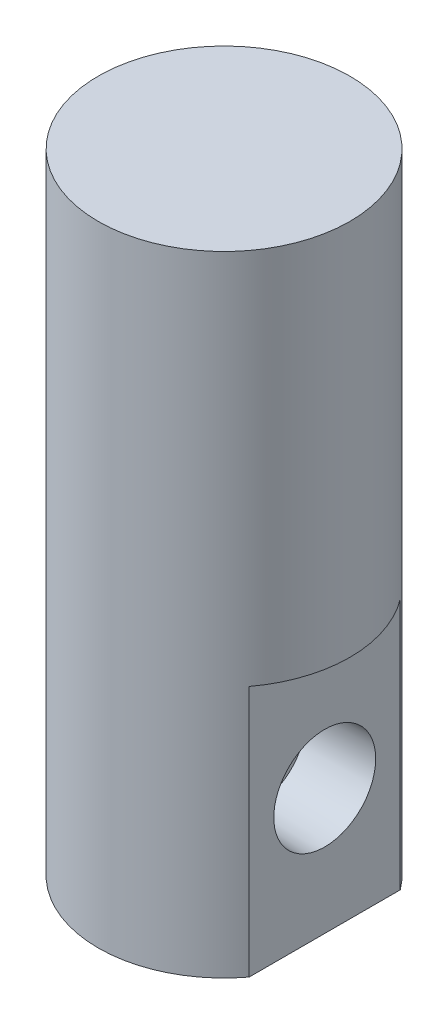
from build123d import *

# Parameters (mm, degrees)
SKETCH1_R           = 12.7
BOSS_EXTRUDE1_DEPTH = 63.5
CUT_EXTRUDE1_DEPTH  = 25.4


with BuildPart() as part:
    # Sketch1 → Boss-Extrude1 (new body)
    with BuildSketch(Plane(origin=(0, 0, 0), x_dir=(1, 0, 0), z_dir=(0, 1, 0))):
        with Locations(Location((0, 0, 0), (0, 0, 270))):
            Circle(SKETCH1_R)
    extrude(amount=BOSS_EXTRUDE1_DEPTH)

    # Sketch2 → Cut-Extrude1 (cut)
    with BuildSketch(Plane.XZ):
        with BuildLine():
            Line((-10.16, 7.62), (-10.16, -7.62))
            ThreePointArc((-10.16, -7.62), (-12.7, 0), (-10.16, 7.62))
        make_face()
        with BuildLine():
            Line((10.16, 7.62), (10.16, -7.62))
            ThreePointArc((10.16, -7.62), (12.7, 0), (10.16, 7.62))
        make_face()
    extrude(amount=-CUT_EXTRUDE1_DEPTH, mode=Mode.SUBTRACT)

    # Sketch4 → 1/8 NPT Tapped Hole1 (revolve, cut)
    with BuildSketch(Plane(origin=(-10.16, 12.7, 0), x_dir=(0, 0, 1), z_dir=(0, 1, 0))):
        Polygon((0, 0), (0, 14.217468714), (4.2164, 11.684), (4.2164, 6.858), (4.936181096, 6.858), (5.1415188, 0), align=None)
    f_1_8_npt_tapped_hole1 = revolve(axis=Axis((-16.51, 12.7, 0), (1, 0, 0)), mode=Mode.SUBTRACT)

    # Mirror1: 1/8 NPT Tapped Hole1 across plane
    add(f_1_8_npt_tapped_hole1.mirror(Plane(origin=(0, 0, 0), x_dir=(0, 0, 1), z_dir=(1, 0, 0))), mode=Mode.SUBTRACT)


solid = part.part
